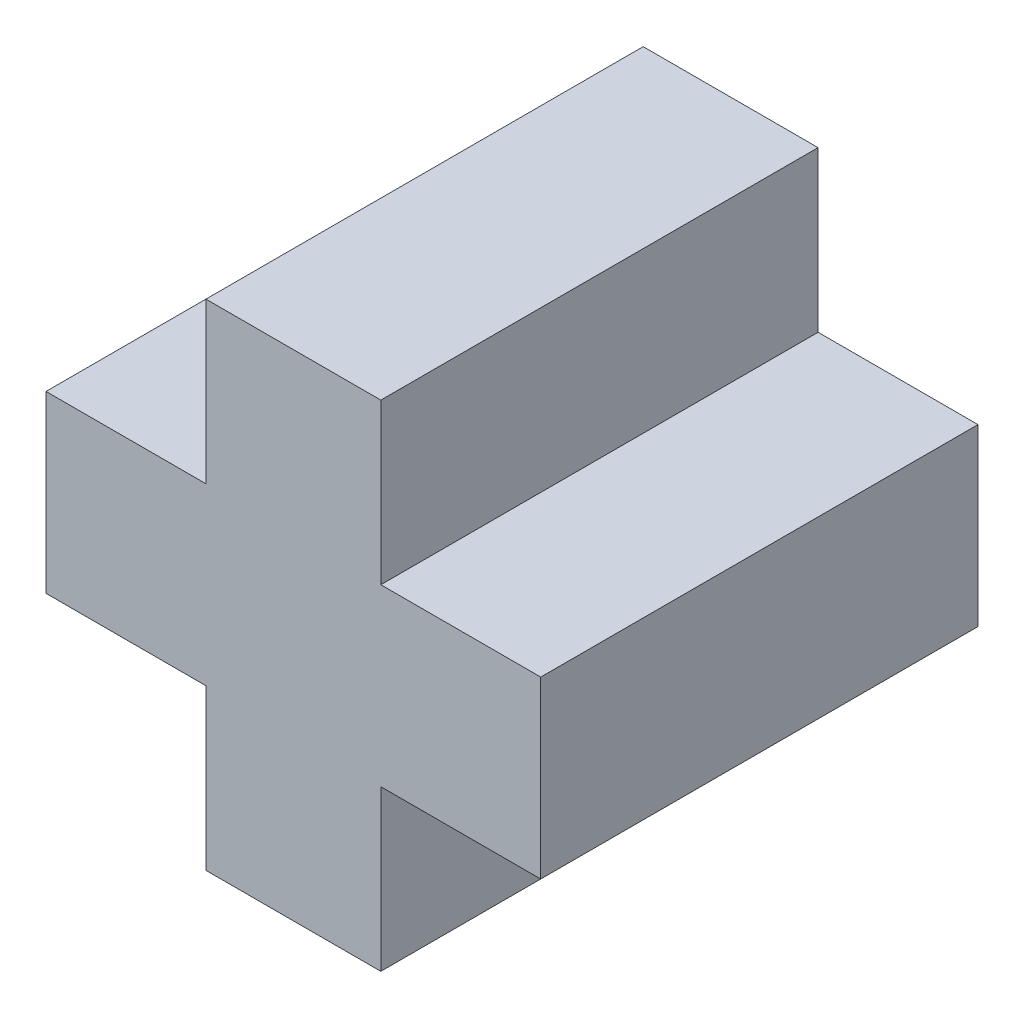
from build123d import *

# Parameters (mm, degrees)
BOSS_EXTRUDE1_DEPTH = 12.5


with BuildPart() as part:
    # Sketch1 → Boss-Extrude1 (new, symmetric)
    with BuildSketch(Plane.XY):
        Polygon((-5, 14.142135624), (-5, 5), (-14.142135624, 5), (-14.142135624, -5), (-5, -5), (-5, -14.142135624), (5, -14.142135624), (5, -5), (14.142135624, -5), (14.142135624, 5), (5, 5), (5, 14.142135624), align=None)
    extrude(amount=BOSS_EXTRUDE1_DEPTH, both=True)


solid = part.part
